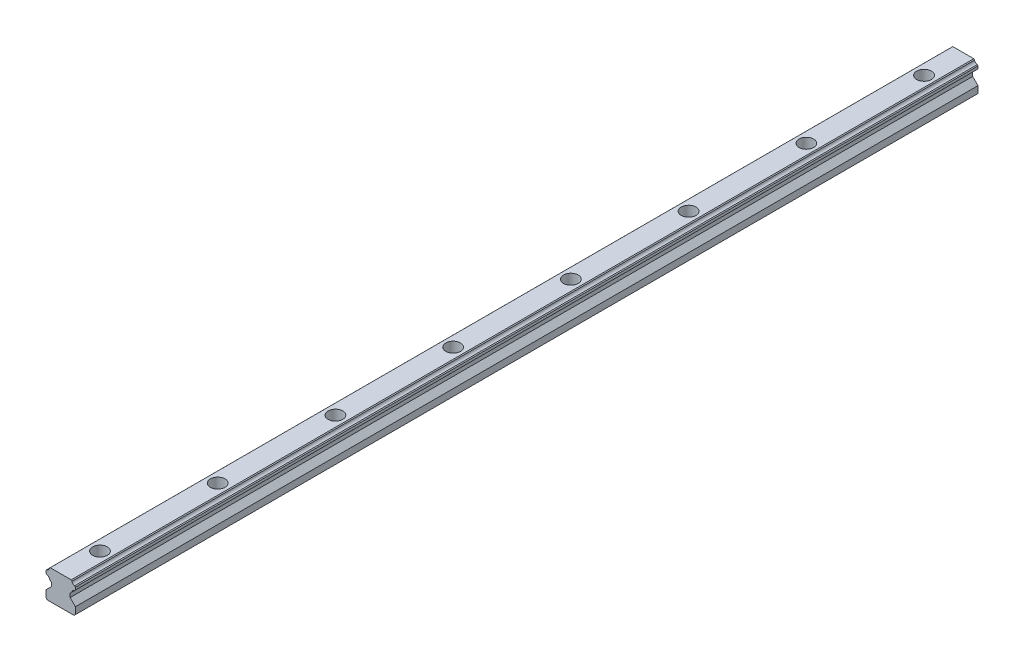
from build123d import *

# Parameters (mm, degrees)
EXTRUDE1_DEPTH  = 460
LPATTERN1_COUNT = 8
LPATTERN1_PITCH = 60


with BuildPart() as part:
    # Sketch1 → Extrude1 (new body)
    with BuildSketch(Plane(origin=(-20, 0, 0), x_dir=(1, 0, 0), z_dir=(0, 0, 1))):
        with BuildLine():
            Line((12.5, 0.69999271), (13.199992786, 0))
            Line((13.199992786, 0), (26.800007214, 0))
            Line((26.800007214, 0), (27.5, 0.69999271))
            Line((27.5, 0.69999271), (27.5, 4.2000246))
            Line((27.5, 4.2000246), (24.8000183, 6.9000063))
            Line((24.8000183, 6.9000063), (24.8000183, 8.8400054))
            Line((24.8000183, 8.8400054), (25.755946813, 9.794179118))
            ThreePointArc((25.755946813, 9.794179118), (26.198484624, 10.690600567), (27.09432569, 11.13431209))
            Line((27.09432569, 11.13431209), (27.5, 11.5399866))
            Line((27.5, 11.5399866), (27.5, 12.8500204))
            Line((27.5, 12.8500204), (27.09432569, 13.268442751))
            ThreePointArc((27.09432569, 13.268442751), (26.202460867, 13.706434947), (25.755946813, 14.594063938))
            Line((25.755946813, 14.594063938), (25.3500197, 15))
            Line((25.3500197, 15), (14.6499803, 15))
            Line((14.6499803, 15), (14.244053187, 14.594063938))
            ThreePointArc((14.244053187, 14.594063938), (13.797539133, 13.706434947), (12.90567431, 13.268442751))
            Line((12.90567431, 13.268442751), (12.5, 12.8500204))
            Line((12.5, 12.8500204), (12.5, 11.5399866))
            Line((12.5, 11.5399866), (12.90567431, 11.13431209))
            ThreePointArc((12.90567431, 11.13431209), (13.801515376, 10.690600567), (14.244053187, 9.794179118))
            Line((14.244053187, 9.794179118), (15.1999817, 8.8400054))
            Line((15.1999817, 8.8400054), (15.1999817, 6.9000063))
            Line((15.1999817, 6.9000063), (12.5, 4.2000246))
            Line((12.5, 4.2000246), (12.5, 0.69999271))
        make_face()
    extrude(amount=-EXTRUDE1_DEPTH)

    # Sketch2 → Cut-Revolve1 (revolve, cut)
    with BuildSketch(Plane(origin=(0, 0, 0), x_dir=(0, 0, -1), z_dir=(1, 0, 0)), mode=Mode.PRIVATE) as cut_revolve1_sk:
        Polygon((20, 15), (23.75, 15), (23.75, 9.7), (22.25, 9.7), (22.25, 0), (20, 0), align=None)
    cut_revolve1 = revolve(cut_revolve1_sk.sketch.rotate(Axis((0, 0, -20), (0, 1, 0)), 180), axis=Axis((0, 0, -20), (0, 1, 0)), mode=Mode.SUBTRACT)

    # LPattern1: Cut-Revolve1 ×8
    with Locations(*[(0, 0, -i * LPATTERN1_PITCH) for i in range(1, LPATTERN1_COUNT)]):
        add(cut_revolve1, mode=Mode.SUBTRACT)


solid = part.part
